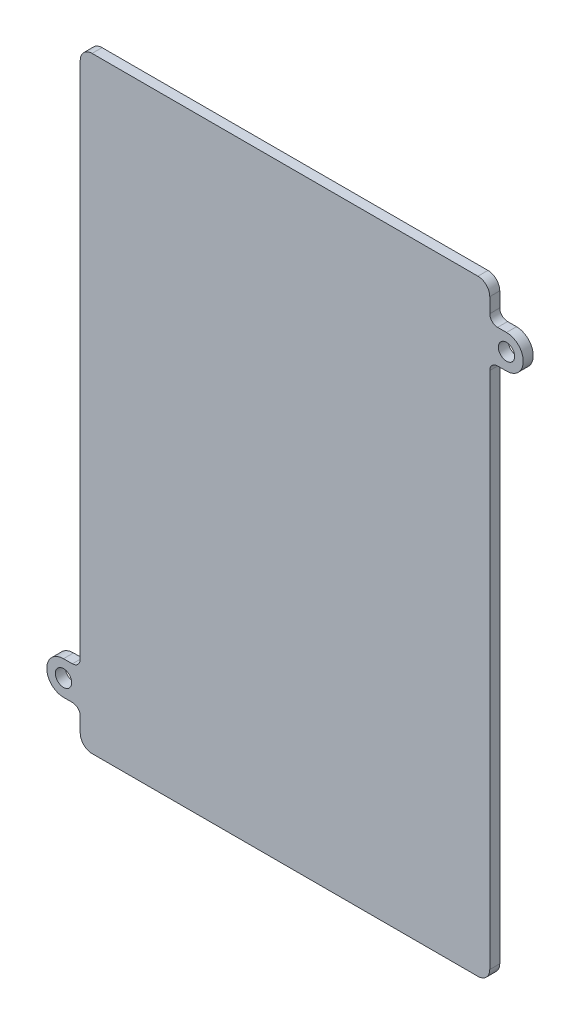
from build123d import *

# Parameters (mm, degrees)
BOSS_EXTRUDE1_DEPTH = 2.54
SKETCH2_R           = 2.075
CUT_EXTRUDE1_DEPTH  = 10
FILLET1_R           = 2


with BuildPart() as part:
    # Sketch1 → Boss-Extrude1 (new body)
    with BuildSketch(Plane.XY):
        with BuildLine():
            Line((52, -74), (52, 59.75))
            Line((52, 59.75), (56.25, 59.75))
            ThreePointArc((56.25, 59.75), (60.5, 64), (56.25, 68.25))
            Line((56.25, 68.25), (52, 68.25))
            Line((52, 68.25), (52, 74))
            ThreePointArc((52, 74), (51.121320344, 76.121320344), (49, 77))
            Line((49, 77), (-49, 77))
            ThreePointArc((-49, 77), (-51.121320344, 76.121320344), (-52, 74))
            Line((-52, 74), (-52, -59.75))
            Line((-52, -59.75), (-56.25, -59.75))
            ThreePointArc((-56.25, -59.75), (-60.5, -64), (-56.25, -68.25))
            Line((-56.25, -68.25), (-52, -68.25))
            Line((-52, -68.25), (-52, -74))
            ThreePointArc((-52, -74), (-51.121320344, -76.121320344), (-49, -77))
            Line((-49, -77), (49, -77))
            ThreePointArc((49, -77), (51.121320344, -76.121320344), (52, -74))
        make_face()
    extrude(amount=BOSS_EXTRUDE1_DEPTH)

    # Sketch2 → Cut-Extrude1 (cut)
    with BuildSketch(Plane.XY.offset(2.54)):
        with Locations((56.25, 64)):
            Circle(SKETCH2_R)
        with Locations((-56.25, -64)):
            Circle(SKETCH2_R)
    extrude(amount=-CUT_EXTRUDE1_DEPTH, mode=Mode.SUBTRACT)

    # Fillet1
    fillet1_edges = [part.edges().sort_by_distance(p)[0] for p in [
        (-52, -68.25, 1.27),
        (-52, -59.75, 1.27),
        (52, 68.25, 1.27),
        (52, 59.75, 1.27),
    ]]
    fillet(fillet1_edges, radius=FILLET1_R)


solid = part.part
